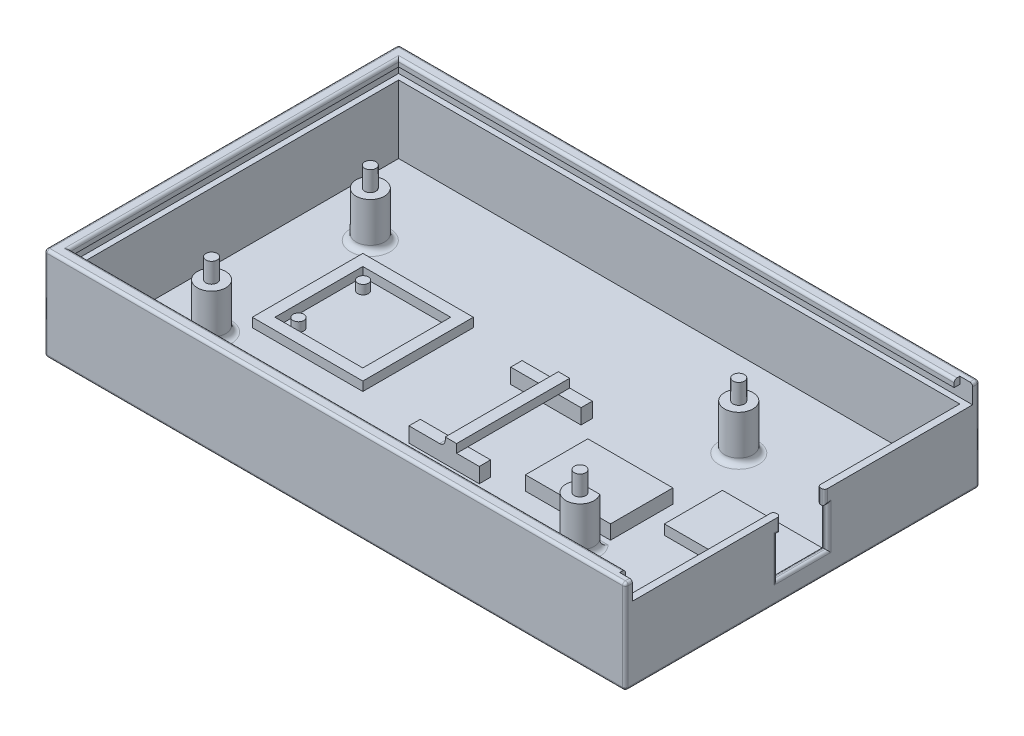
from build123d import *

# Parameters (mm, degrees)
SKETCH_1_W          = 100
SKETCH_1_H          = 60
EXTRUDE_1_DEPTH     = 1.25
SKETCH_2_R          = 1
EXTRUDE_2_DEPTH     = 11.5
SKETCH_4_W          = 102.5
SKETCH_4_H          = 62.5
SKETCH_4_W_2        = 100
SKETCH_4_H_2        = 60
EXTRUDE_3_DEPTH     = 16.5
SKETCH_6_R          = 2.5
EXTRUDE_4_DEPTH     = 8
SKETCH_10_W         = 60
SKETCH_10_H         = 3.25
CUT_EXTRUDE_2_DEPTH = 101.25
SKETCH_11_W         = 1
SKETCH_11_H         = 1.25
EXTRUDE_8_DEPTH     = 101.25
SKETCH_12_W         = 1
SKETCH_12_H         = 1.25
CUT_EXTRUDE_5_DEPTH = 2.25
SKETCH_13_W         = 58
SKETCH_13_H         = 1.25
EXTRUDE_9_DEPTH     = 1
CUT_EXTRUDE_6_DEPTH = 1.75
FILLET_2_R          = 0.5
SKETCH_15_W         = 19.5
SKETCH_15_H         = 19.5
SKETCH_15_W_2       = 15.5
SKETCH_15_H_2       = 15.5
SKETCH_15_R         = 0.95
EXTRUDE_11_DEPTH    = 1.6
SKETCH_16_W         = 18
SKETCH_16_H         = 10.25
SKETCH_16_W_2       = 15
SKETCH_16_H_2       = 11
EXTRUDE_12_DEPTH    = 1.75
EXTRUDE_13_DEPTH    = 2.65
CUT_EXTRUDE_7_DEPTH = 62.93292743
FILLET_3_R          = 1
SKETCH_20_W         = 2
SKETCH_20_H         = 19.95
EXTRUDE_14_DEPTH    = 1.5
SKETCH_21_W         = 15
SKETCH_21_H         = 11
EXTRUDE_15_DEPTH    = 0.75
EXTRUDE_16_DEPTH    = 10.75
FILLET_4_R          = 1


with BuildPart() as part:
    # ｽｹｯﾁ1 → ﾎﾞｽ - 押し出し1 (new body)
    with BuildSketch(Plane(origin=(0, 0, 0), x_dir=(1, 0, 0), z_dir=(0, 1, 0))):
        Rectangle(SKETCH_1_W, SKETCH_1_H)
    extrude(amount=EXTRUDE_1_DEPTH)

    # ｽｹｯﾁ2 → ﾎﾞｽ - 押し出し2 (add)
    with BuildSketch(Plane(origin=(0, 1.25, 0), x_dir=(1, 0, 0), z_dir=(0, 1, 0))):
        with Locations(Location((-39, 14, 0), (0, 0, 90))):
            Circle(SKETCH_2_R)
        with Locations(Location((26, 14, 0), (0, 0, 90))):
            Circle(SKETCH_2_R)
        with Locations(Location((26, -14, 0), (0, 0, 90))):
            Circle(SKETCH_2_R)
        with Locations(Location((-39, -14, 0), (0, 0, 90))):
            Circle(SKETCH_2_R)
    extrude(amount=EXTRUDE_2_DEPTH)

    # ｽｹｯﾁ4 → ﾎﾞｽ - 押し出し3 (add)
    with BuildSketch(Plane.XZ):
        Rectangle(SKETCH_4_W, SKETCH_4_H)
        Rectangle(SKETCH_4_W_2, SKETCH_4_H_2, mode=Mode.SUBTRACT)
    extrude(amount=-EXTRUDE_3_DEPTH)

    # ｽｹｯﾁ6 → ﾎﾞｽ - 押し出し4 (add)
    with BuildSketch(Plane(origin=(0, 1.25, 0), x_dir=(1, 0, 0), z_dir=(0, 1, 0))):
        with Locations(Location((-39, 14, 0), (0, 0, 90))):
            Circle(SKETCH_6_R)
        with Locations(Location((26, 14, 0), (0, 0, 90))):
            Circle(SKETCH_6_R)
        with Locations(Location((26, -14, 0), (0, 0, 90))):
            Circle(SKETCH_6_R)
        with Locations(Location((-39, -14, 0), (0, 0, 90))):
            Circle(SKETCH_6_R)
    extrude(amount=EXTRUDE_4_DEPTH)

    # ｽｹｯﾁ10 → ｶｯﾄ - 押し出し2 (cut)
    with BuildSketch(Plane(origin=(51.25, 0, 0), x_dir=(0, 0, -1), z_dir=(1, 0, 0))):
        with Locations((0, 14.875)):
            Rectangle(SKETCH_10_W, SKETCH_10_H)
    extrude(amount=-CUT_EXTRUDE_2_DEPTH, mode=Mode.SUBTRACT)

    # ｽｹｯﾁ11 → ﾎﾞｽ - 押し出し8 (add)
    with BuildSketch(Plane(origin=(51.25, 0, 0), x_dir=(0, 0, -1), z_dir=(1, 0, 0))):
        with Locations((-29.5, 15.875)):
            Rectangle(SKETCH_11_W, SKETCH_11_H)
        with Locations((29.5, 15.875)):
            Rectangle(SKETCH_11_W, SKETCH_11_H)
        with Locations((-29.5, 12.625)):
            Rectangle(SKETCH_11_W, SKETCH_11_H)
        with Locations((29.5, 12.625)):
            Rectangle(SKETCH_11_W, SKETCH_11_H)
    extrude(amount=-EXTRUDE_8_DEPTH)

    # ｽｹｯﾁ12 → ｶｯﾄ - 押し出し5 (cut)
    with BuildSketch(Plane(origin=(51.25, 0, 0), x_dir=(0, 0, -1), z_dir=(1, 0, 0))):
        with Locations((-29.5, 15.875)):
            Rectangle(SKETCH_12_W, SKETCH_12_H)
        with Locations((29.5, 15.875)):
            Rectangle(SKETCH_12_W, SKETCH_12_H)
    extrude(amount=-CUT_EXTRUDE_5_DEPTH, mode=Mode.SUBTRACT)

    # ｽｹｯﾁ13 → ﾎﾞｽ - 押し出し9 (add)
    with BuildSketch(Plane(origin=(-50, 0, 0), x_dir=(0, 0, -1), z_dir=(1, 0, 0))):
        with Locations((0, 15.875)):
            Rectangle(SKETCH_13_W, SKETCH_13_H)
        with Locations((0, 12.625)):
            Rectangle(SKETCH_13_W, SKETCH_13_H)
    extrude(amount=EXTRUDE_9_DEPTH)

    # ｽｹｯﾁ14 → ｶｯﾄ - 押し出し6 (cut)
    with BuildSketch(Plane(origin=(51.25, 0, 0), x_dir=(0, 0, -1), z_dir=(1, 0, 0))):
        Polygon((0, 13.25), (-3.9, 13.25), (-3.9, 10.7), (-4.5, 10.7), (-4.5, 3.7), (0, 3.7), align=None)
        Polygon((3.9, 13.25), (0, 13.25), (0, 3.7), (4.5, 3.7), (4.5, 10.7), (3.9, 10.7), align=None)
    extrude(amount=-CUT_EXTRUDE_6_DEPTH, mode=Mode.SUBTRACT)

    # ﾌｨﾚｯﾄ2
    fillet_2_edges = [part.edges().sort_by_distance(p)[0] for p in [
        (51.25, 16.5, 30.625),
        (0, 16.5, -29),
        (0, 16.5, 29),
        (-49, 16.5, 0),
        (50, 3.7, 0),
        (50, 7.2, 4.5),
        (51.25, 10.7, 4.2),
        (51.25, 10.7, -4.2),
        (51.25, 7.2, -4.5),
        (51.25, 11.975, 3.9),
        (51.25, 11.975, -3.9),
        (50, 10.7, 4.2),
        (50, 11.975, 3.9),
        (50, 11.975, -3.9),
        (50, 10.7, -4.2),
        (50, 7.2, -4.5),
        (51.25, 3.7, 0),
        (51.25, 7.2, 4.5),
        (51.25, 16.5, -30.625),
        (51.25, 8.25, 31.25),
        (0, 16.5, -31.25),
        (51.25, 8.25, -31.25),
        (-51.25, 16.5, 0),
        (-51.25, 8.25, -31.25),
        (0, 16.5, 31.25),
        (-51.25, 8.25, 31.25),
        (51.25, 0, 0),
        (0, 0, 31.25),
        (-51.25, 0, 0),
        (0, 0, -31.25),
    ]]
    fillet(fillet_2_edges, radius=FILLET_2_R)

    # ｽｹｯﾁ15 → ﾎﾞｽ - 押し出し11 (add)
    # profile 1 of 3: a face of its own
    with BuildSketch(Plane(origin=(0, 1.25, 0), x_dir=(1, 0, 0), z_dir=(0, 1, 0))):
        with Locations((-26.318525092, 0)):
            Rectangle(SKETCH_15_W, SKETCH_15_H)
        with Locations((-26.318525092, 0)):
            Rectangle(SKETCH_15_W_2, SKETCH_15_H_2, mode=Mode.SUBTRACT)
    # profile 2 of 3: a face of its own
    with BuildSketch(Plane(origin=(0, 1.25, 0), x_dir=(1, 0, 0), z_dir=(0, 1, 0))):
        with Locations(Location((-31.968525092, -5.7, 0), (0, 0, 90))):
            Circle(SKETCH_15_R)
    # profile 3 of 3: a face of its own
    with BuildSketch(Plane(origin=(0, 1.25, 0), x_dir=(1, 0, 0), z_dir=(0, 1, 0))):
        with Locations(Location((-31.968525092, 5.7, 0), (0, 0, 90))):
            Circle(SKETCH_15_R)
    extrude(amount=EXTRUDE_11_DEPTH)

    # ｽｹｯﾁ16 → ﾎﾞｽ - 押し出し12 (add)
    with BuildSketch(Plane(origin=(0, 1.25, 0), x_dir=(1, 0, 0), z_dir=(0, 1, 0))):
        with Locations((41, 0)):
            Rectangle(SKETCH_16_W, SKETCH_16_H)
        with Locations((20.5, -5.125)):
            Rectangle(SKETCH_16_W_2, SKETCH_16_H_2)
    extrude(amount=EXTRUDE_12_DEPTH)

    # ｽｹｯﾁ17 → ﾎﾞｽ - 押し出し13 (add)
    with BuildSketch(Plane(origin=(0, 1.25, 0), x_dir=(1, 0, 0), z_dir=(0, 1, 0))):
        Polygon((7.8, -13.575), (7.8, -11.575), (5.8, -11.575), (-4.6, -11.575), (-4.6, -13.575), align=None)
        Polygon((7.8, 6.375), (-4.6, 6.375), (-4.6, 4.375), (5.8, 4.375), (7.8, 4.375), align=None)
    extrude(amount=EXTRUDE_13_DEPTH)

    # ｽｹｯﾁ19 → ｶｯﾄ - 押し出し7 (cut, through all)
    with BuildSketch(Plane(origin=(0, 1.25, 0), x_dir=(1, 0, 0), z_dir=(0, 1, 0))):
        with BuildLine():
            Line((23.963458815, -12.55), (28.036541185, -12.55))
            ThreePointArc((28.036541185, -12.55), (26, -11.5), (23.963458815, -12.55))
        make_face()
    extrude(amount=CUT_EXTRUDE_7_DEPTH, mode=Mode.SUBTRACT)

    # ﾌｨﾚｯﾄ3
    fillet_3_edges = [part.edges().sort_by_distance(p)[0] for p in [
        (26, 1.25, 12.55),
        (-39, 1.25, -11.5),
        (26, 1.25, -11.5),
        (26, 1.25, 16.5),
        (-39, 1.25, 16.5),
    ]]
    fillet(fillet_3_edges, radius=FILLET_3_R)

    # ｽｹｯﾁ20 → ﾎﾞｽ - 押し出し14 (add)
    with BuildSketch(Plane(origin=(0, 3.9, 0), x_dir=(-1, 0, 0), z_dir=(0, 1, 0))):
        with Locations((-2.8, 3.6)):
            Rectangle(SKETCH_20_W, SKETCH_20_H)
    extrude(amount=EXTRUDE_14_DEPTH)

    # ｽｹｯﾁ21 → ﾎﾞｽ - 押し出し15 (add)
    with BuildSketch(Plane(origin=(0, 3, 0), x_dir=(1, 0, 0), z_dir=(0, 1, 0))):
        with Locations((20.5, -5.125)):
            Rectangle(SKETCH_21_W, SKETCH_21_H)
    extrude(amount=EXTRUDE_15_DEPTH)

    # ｽｹｯﾁ22 → ﾎﾞｽ - 押し出し16 (add)
    with BuildSketch(Plane(origin=(0, 1.25, 0), x_dir=(1, 0, 0), z_dir=(0, 1, 0))):
        Polygon((-50, -30), (50, -30), (50, -29), (-49, -29), (-49, 29), (50, 29), (50, 30), (-50, 30), align=None)
    extrude(amount=EXTRUDE_16_DEPTH)

    # ﾌｨﾚｯﾄ4
    fillet_4_edges = [part.edges().sort_by_distance(p)[0] for p in [
        (1.8, 3.9, -5.375),
        (1.8, 3.9, 12.575),
    ]]
    fillet(fillet_4_edges, radius=FILLET_4_R)


solid = part.part
